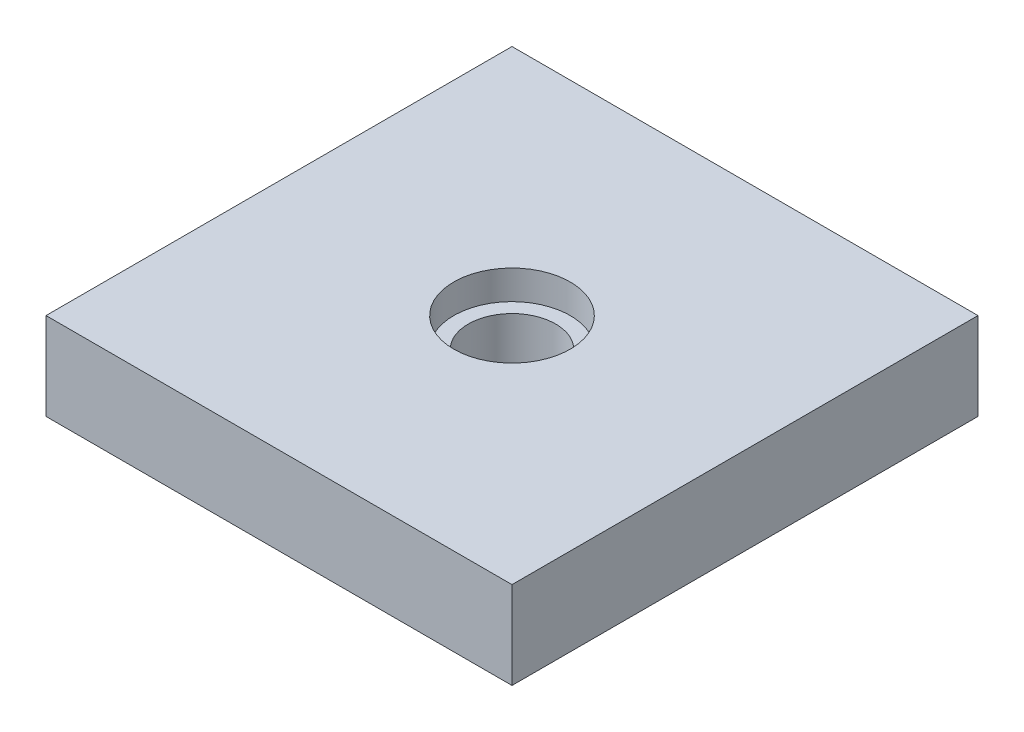
from build123d import *

# Parameters (mm, degrees)
SKETCH1_W           = 203.2
SKETCH1_H           = 203.2
BOSS_EXTRUDE1_DEPTH = 38.1
SKETCH2_R           = 25.4
CUT_EXTRUDE1_DEPTH  = 12.7
SKETCH3_R           = 19.05
CUT_EXTRUDE2_DEPTH  = 146.911891222


with BuildPart() as part:
    # Sketch1 → Boss-Extrude1 (new body)
    with BuildSketch(Plane.XZ):
        Rectangle(SKETCH1_W, SKETCH1_H)
    extrude(amount=BOSS_EXTRUDE1_DEPTH)

    # Sketch2 → Cut-Extrude1 (cut)
    with BuildSketch(Plane(origin=(0, 0, 0), x_dir=(1, 0, 0), z_dir=(0, 1, 0))):
        with Locations(Location((0, 0, 0), (0, 0, 270))):
            Circle(SKETCH2_R)
    extrude(amount=-CUT_EXTRUDE1_DEPTH, mode=Mode.SUBTRACT)

    # Sketch3 → Cut-Extrude2 (cut, through all)
    with BuildSketch(Plane(origin=(0, -12.7, 0), x_dir=(1, 0, 0), z_dir=(0, 1, 0))):
        with Locations(Location((0, 0, 0), (0, 0, 270))):
            Circle(SKETCH3_R)
    extrude(amount=-CUT_EXTRUDE2_DEPTH, mode=Mode.SUBTRACT)


solid = part.part
